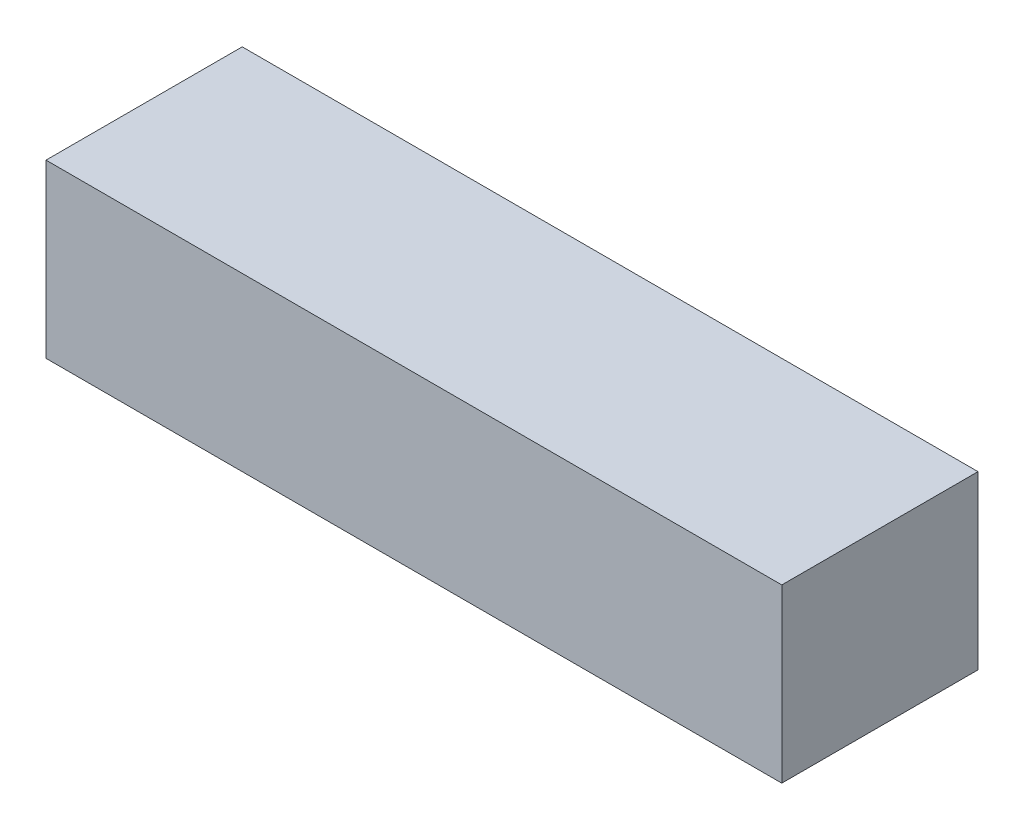
from build123d import *

# Parameters (mm, degrees)
SKETCH1_W           = 150
SKETCH1_H           = 40
BOSS_EXTRUDE1_DEPTH = 35


with BuildPart() as part:
    # Sketch1 → Boss-Extrude1 (new body)
    with BuildSketch(Plane(origin=(0, 0, 0), x_dir=(1, 0, 0), z_dir=(0, 1, 0))):
        Rectangle(SKETCH1_W, SKETCH1_H)
    extrude(amount=BOSS_EXTRUDE1_DEPTH)


solid = part.part
